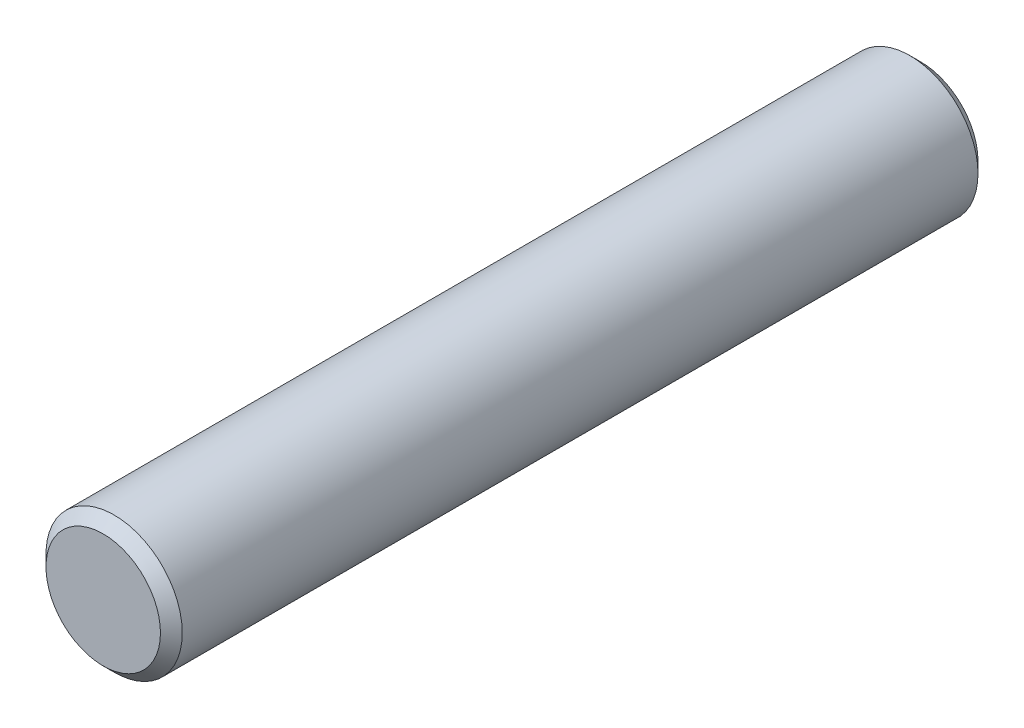
from build123d import *

# Parameters (mm, degrees)
SKETCH1_R           = 2.5
BOSS_EXTRUDE1_DEPTH = 30
CHAMFER1_SIZE       = 0.4


with BuildPart() as part:
    # Sketch1 → Boss-Extrude1 (new body)
    with BuildSketch(Plane.XY):
        Circle(SKETCH1_R)
    extrude(amount=BOSS_EXTRUDE1_DEPTH)

    # Chamfer1
    chamfer1_edges = [part.edges().sort_by_distance(p)[0] for p in [
        (-2.5, 0, 0),
        (-2.5, 0, 30),
    ]]
    chamfer(chamfer1_edges, length=CHAMFER1_SIZE)


solid = part.part
